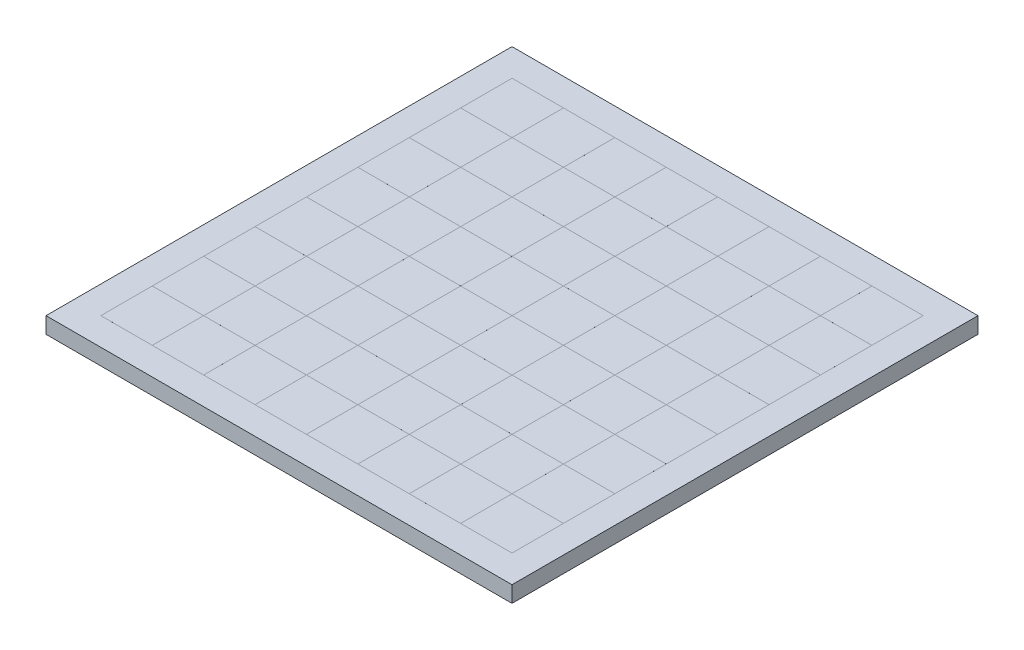
from build123d import *

# Parameters (mm, degrees)
SKETCH1_W           = 431.8
SKETCH1_H           = 431.8
BOSS_EXTRUDE1_DEPTH = 5
SKETCH2_W           = 47.625
SKETCH2_H           = 47.625
BOSS_EXTRUDE2_DEPTH = 0.001
SKETCH3_W           = 431.8
SKETCH3_H           = 431.8
BOSS_EXTRUDE3_DEPTH = 10


with BuildPart() as part:
    # Sketch1 → Boss-Extrude1 (new body)
    with BuildSketch(Plane(origin=(0, 0, 0), x_dir=(1, 0, 0), z_dir=(0, 1, 0))):
        with Locations((215.9, 215.9)):
            Rectangle(SKETCH1_W, SKETCH1_H)
    extrude(amount=BOSS_EXTRUDE1_DEPTH)

    # Sketch2 → Boss-Extrude2 (add)
    with BuildSketch(Plane(origin=(0, 5, 0), x_dir=(1, 0, 0), z_dir=(0, 1, 0))):
        with Locations((49.2125, 49.2125)):
            Rectangle(SKETCH2_W, SKETCH2_H)
        with Locations((49.2125, 96.8425)):
            Rectangle(SKETCH2_W, SKETCH2_H)
        with Locations((49.2125, 144.4725)):
            Rectangle(SKETCH2_W, SKETCH2_H)
        with Locations((49.2125, 192.1025)):
            Rectangle(SKETCH2_W, SKETCH2_H)
        with Locations((49.2125, 239.7325)):
            Rectangle(SKETCH2_W, SKETCH2_H)
        with Locations((49.2125, 287.3625)):
            Rectangle(SKETCH2_W, SKETCH2_H)
        with Locations((49.2125, 334.9925)):
            Rectangle(SKETCH2_W, SKETCH2_H)
        with Locations((49.2125, 382.6225)):
            Rectangle(SKETCH2_W, SKETCH2_H)
        with Locations((96.8425, 96.8425)):
            Rectangle(SKETCH2_W, SKETCH2_H)
        with Locations((96.8425, 144.4725)):
            Rectangle(SKETCH2_W, SKETCH2_H)
        with Locations((96.8425, 192.1025)):
            Rectangle(SKETCH2_W, SKETCH2_H)
        with Locations((96.8425, 239.7325)):
            Rectangle(SKETCH2_W, SKETCH2_H)
        with Locations((96.8425, 287.3625)):
            Rectangle(SKETCH2_W, SKETCH2_H)
        with Locations((96.8425, 334.9925)):
            Rectangle(SKETCH2_W, SKETCH2_H)
        with Locations((96.8425, 382.6225)):
            Rectangle(SKETCH2_W, SKETCH2_H)
        with Locations((144.4725, 96.8425)):
            Rectangle(SKETCH2_W, SKETCH2_H)
        with Locations((144.4725, 144.4725)):
            Rectangle(SKETCH2_W, SKETCH2_H)
        with Locations((144.4725, 192.1025)):
            Rectangle(SKETCH2_W, SKETCH2_H)
        with Locations((144.4725, 239.7325)):
            Rectangle(SKETCH2_W, SKETCH2_H)
        with Locations((144.4725, 287.3625)):
            Rectangle(SKETCH2_W, SKETCH2_H)
        with Locations((144.4725, 334.9925)):
            Rectangle(SKETCH2_W, SKETCH2_H)
        with Locations((144.4725, 382.6225)):
            Rectangle(SKETCH2_W, SKETCH2_H)
        with Locations((192.1025, 96.8425)):
            Rectangle(SKETCH2_W, SKETCH2_H)
        with Locations((192.1025, 144.4725)):
            Rectangle(SKETCH2_W, SKETCH2_H)
        with Locations((192.1025, 192.1025)):
            Rectangle(SKETCH2_W, SKETCH2_H)
        with Locations((192.1025, 239.7325)):
            Rectangle(SKETCH2_W, SKETCH2_H)
        with Locations((192.1025, 287.3625)):
            Rectangle(SKETCH2_W, SKETCH2_H)
        with Locations((192.1025, 334.9925)):
            Rectangle(SKETCH2_W, SKETCH2_H)
        with Locations((192.1025, 382.6225)):
            Rectangle(SKETCH2_W, SKETCH2_H)
        with Locations((239.7325, 96.8425)):
            Rectangle(SKETCH2_W, SKETCH2_H)
        with Locations((239.7325, 144.4725)):
            Rectangle(SKETCH2_W, SKETCH2_H)
        with Locations((239.7325, 192.1025)):
            Rectangle(SKETCH2_W, SKETCH2_H)
        with Locations((239.7325, 239.7325)):
            Rectangle(SKETCH2_W, SKETCH2_H)
        with Locations((239.7325, 287.3625)):
            Rectangle(SKETCH2_W, SKETCH2_H)
        with Locations((239.7325, 334.9925)):
            Rectangle(SKETCH2_W, SKETCH2_H)
        with Locations((239.7325, 382.6225)):
            Rectangle(SKETCH2_W, SKETCH2_H)
        with Locations((287.3625, 96.8425)):
            Rectangle(SKETCH2_W, SKETCH2_H)
        with Locations((287.3625, 144.4725)):
            Rectangle(SKETCH2_W, SKETCH2_H)
        with Locations((287.3625, 192.1025)):
            Rectangle(SKETCH2_W, SKETCH2_H)
        with Locations((287.3625, 239.7325)):
            Rectangle(SKETCH2_W, SKETCH2_H)
        with Locations((287.3625, 287.3625)):
            Rectangle(SKETCH2_W, SKETCH2_H)
        with Locations((287.3625, 334.9925)):
            Rectangle(SKETCH2_W, SKETCH2_H)
        with Locations((287.3625, 382.6225)):
            Rectangle(SKETCH2_W, SKETCH2_H)
        with Locations((334.9925, 96.8425)):
            Rectangle(SKETCH2_W, SKETCH2_H)
        with Locations((334.9925, 144.4725)):
            Rectangle(SKETCH2_W, SKETCH2_H)
        with Locations((334.9925, 192.1025)):
            Rectangle(SKETCH2_W, SKETCH2_H)
        with Locations((334.9925, 239.7325)):
            Rectangle(SKETCH2_W, SKETCH2_H)
        with Locations((334.9925, 287.3625)):
            Rectangle(SKETCH2_W, SKETCH2_H)
        with Locations((334.9925, 334.9925)):
            Rectangle(SKETCH2_W, SKETCH2_H)
        with Locations((334.9925, 382.6225)):
            Rectangle(SKETCH2_W, SKETCH2_H)
        with Locations((382.6225, 96.8425)):
            Rectangle(SKETCH2_W, SKETCH2_H)
        with Locations((382.6225, 144.4725)):
            Rectangle(SKETCH2_W, SKETCH2_H)
        with Locations((382.6225, 192.1025)):
            Rectangle(SKETCH2_W, SKETCH2_H)
        with Locations((382.6225, 239.7325)):
            Rectangle(SKETCH2_W, SKETCH2_H)
        with Locations((382.6225, 287.3625)):
            Rectangle(SKETCH2_W, SKETCH2_H)
        with Locations((382.6225, 334.9925)):
            Rectangle(SKETCH2_W, SKETCH2_H)
        with Locations((382.6225, 382.6225)):
            Rectangle(SKETCH2_W, SKETCH2_H)
        with Locations((96.8425, 49.2125)):
            Rectangle(SKETCH2_W, SKETCH2_H)
        with Locations((144.4725, 49.2125)):
            Rectangle(SKETCH2_W, SKETCH2_H)
        with Locations((192.1025, 49.2125)):
            Rectangle(SKETCH2_W, SKETCH2_H)
        with Locations((239.7325, 49.2125)):
            Rectangle(SKETCH2_W, SKETCH2_H)
        with Locations((287.3625, 49.2125)):
            Rectangle(SKETCH2_W, SKETCH2_H)
        with Locations((334.9925, 49.2125)):
            Rectangle(SKETCH2_W, SKETCH2_H)
        with Locations((382.6225, 49.2125)):
            Rectangle(SKETCH2_W, SKETCH2_H)
    extrude(amount=BOSS_EXTRUDE2_DEPTH)

    # Sketch3 → Boss-Extrude3 (add)
    with BuildSketch(Plane.XZ):
        with Locations((215.9, -215.9)):
            Rectangle(SKETCH3_W, SKETCH3_H)
    extrude(amount=BOSS_EXTRUDE3_DEPTH)


solid = part.part
